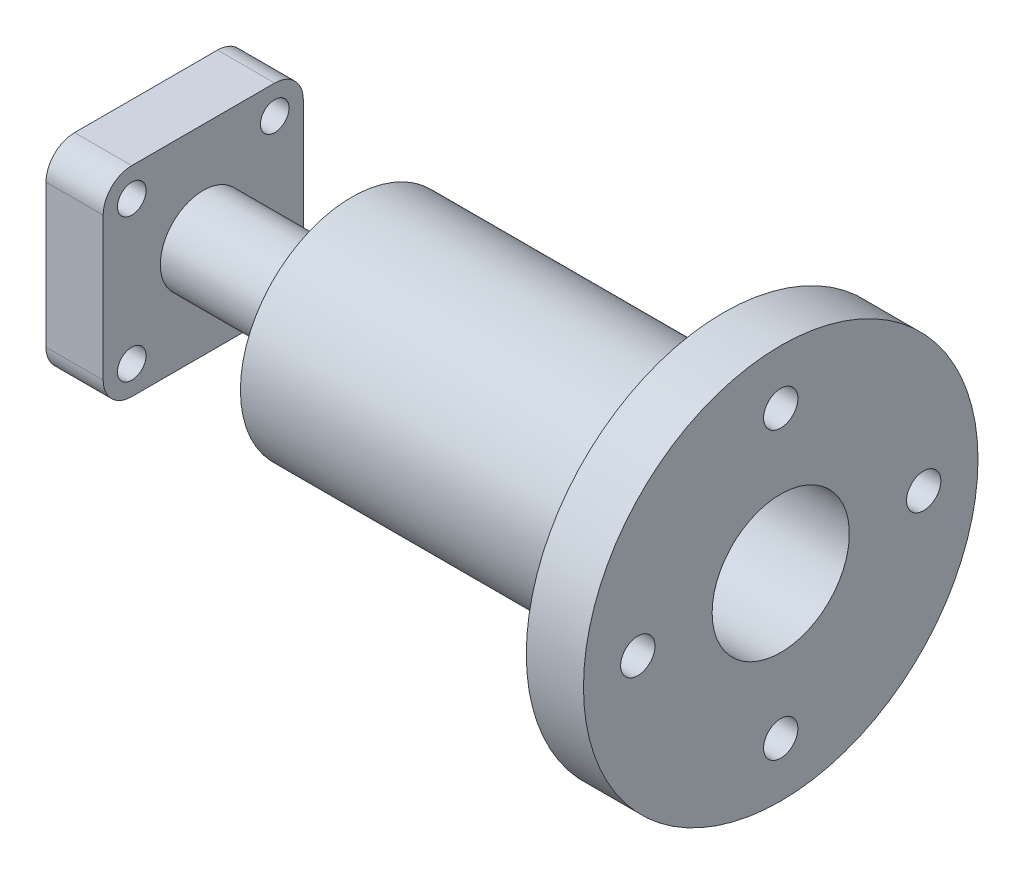
from build123d import *

# Parameters (mm, degrees)
SKETCH2_W           = 70
SKETCH2_H           = 70
BOSS_EXTRUDE1_DEPTH = 20
FILLET1_R           = 10
HOLE1_D             = 10
HOLE1_DEPTH         = 20
HOLE2_D             = 12
CIRPATTERN1_COUNT   = 4


with BuildPart() as part:
    # Sketch1 → Revolve1 (revolve)
    with BuildSketch(Plane(origin=(0, 0, 0), x_dir=(1, 0, 0), z_dir=(0, 1, 0)), mode=Mode.PRIVATE) as revolve1_sk:
        Polygon((0, 15), (52, 15), (52, 39), (182, 39), (182, 69), (202, 69), (202, 24), (58, 24), (58, 9), (0, 9), align=None)
    revolve(revolve1_sk.sketch.rotate(Axis((0, 0, 0), (1, 0, 0)), 180), axis=Axis((0, 0, 0), (1, 0, 0)))

    # Sketch2 → Boss-Extrude1 (add)
    with BuildSketch(Plane.ZY):
        Rectangle(SKETCH2_W, SKETCH2_H)
    extrude(amount=BOSS_EXTRUDE1_DEPTH)

    # Fillet1
    fillet1_edges = [part.edges().sort_by_distance(p)[0] for p in [
        (-10, -35, 35),
        (-10, 35, 35),
        (-10, 35, -35),
        (-10, -35, -35),
    ]]
    fillet(fillet1_edges, radius=FILLET1_R)

    # Hole1
    with Locations(Plane.ZY.offset(20)):
        with Locations((25, 25), (25, -25), (-25, -25), (-25, 25)):
            Hole(HOLE1_D / 2, depth=HOLE1_DEPTH)

    # Hole2 (through all)
    with Locations(Plane.ZY.offset(-182)):
        with Locations((50, 0)):
            hole2 = Hole(HOLE2_D / 2)

    # CirPattern1: Hole2 ×4 about axis
    cirpattern1_axis = Axis((0, 0, 0), (1, 0, 0))
    for i in range(1, CIRPATTERN1_COUNT):
        add(hole2.rotate(cirpattern1_axis, i * 360 / CIRPATTERN1_COUNT), mode=Mode.SUBTRACT)


solid = part.part
